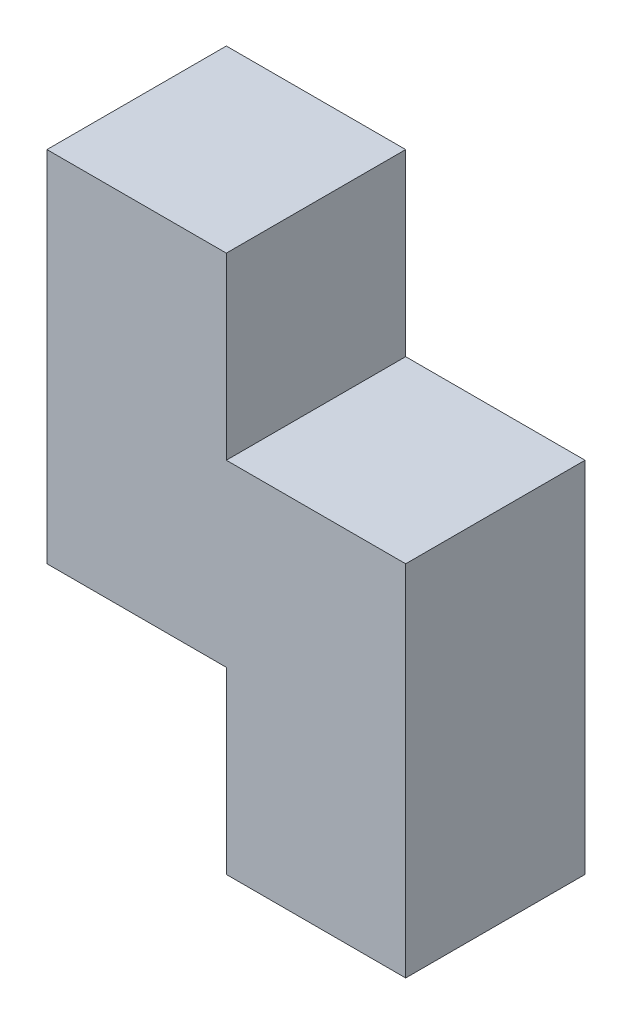
from build123d import *

# Parameters (mm, degrees)
SKETCH1_W           = 90
SKETCH1_H           = 60
BOSS_EXTRUDE1_DEPTH = 15
SKETCH2_W           = 30
SKETCH2_H           = 30
CUT_EXTRUDE1_DEPTH  = 62.846584384


with BuildPart() as part:
    # Sketch1 → Boss-Extrude1 (new, symmetric)
    with BuildSketch(Plane(origin=(0, 0, 0), x_dir=(0, 1, 0), z_dir=(0, 0, 1))):
        Rectangle(SKETCH1_W, SKETCH1_H)
    extrude(amount=BOSS_EXTRUDE1_DEPTH, both=True)

    # Sketch2 → Cut-Extrude1 (cut, through all)
    with BuildSketch(Plane.XY.offset(15)):
        with Locations((-15, -30)):
            Rectangle(SKETCH2_W, SKETCH2_H)
        with Locations((15, 30)):
            Rectangle(SKETCH2_W, SKETCH2_H)
    extrude(amount=-CUT_EXTRUDE1_DEPTH, mode=Mode.SUBTRACT)


solid = part.part
